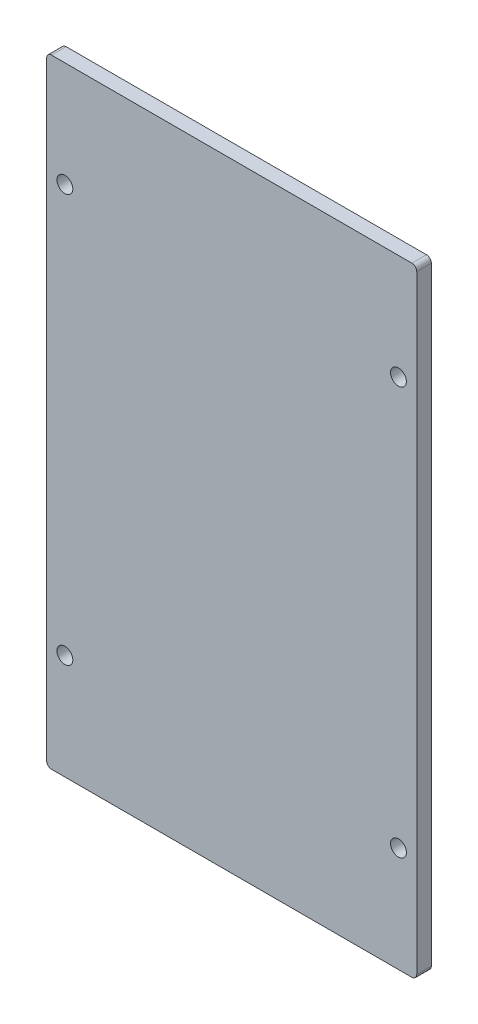
from build123d import *

# Parameters (mm, degrees)
SKETCH1_W           = 76
SKETCH1_H           = 127
SKETCH1_R           = 1.625
BOSS_EXTRUDE1_DEPTH = 3
FILLET1_R           = 1


with BuildPart() as part:
    # Sketch1 → Boss-Extrude1 (new body)
    with BuildSketch(Plane.XY):
        with Locations((38, 63.5)):
            Rectangle(SKETCH1_W, SKETCH1_H)
        with Locations((3.75, 105.375)):
            Circle(SKETCH1_R, mode=Mode.SUBTRACT)
        with Locations((72.25, 105.375)):
            Circle(SKETCH1_R, mode=Mode.SUBTRACT)
        with Locations((72.25, 21.625)):
            Circle(SKETCH1_R, mode=Mode.SUBTRACT)
        with Locations((3.75, 21.625)):
            Circle(SKETCH1_R, mode=Mode.SUBTRACT)
    extrude(amount=BOSS_EXTRUDE1_DEPTH)

    # Fillet1
    fillet1_edges = [part.edges().sort_by_distance(p)[0] for p in [
        (0, 127, 1.5),
        (76, 127, 1.5),
        (76, 0, 1.5),
        (0, 0, 1.5),
    ]]
    fillet(fillet1_edges, radius=FILLET1_R)


solid = part.part
